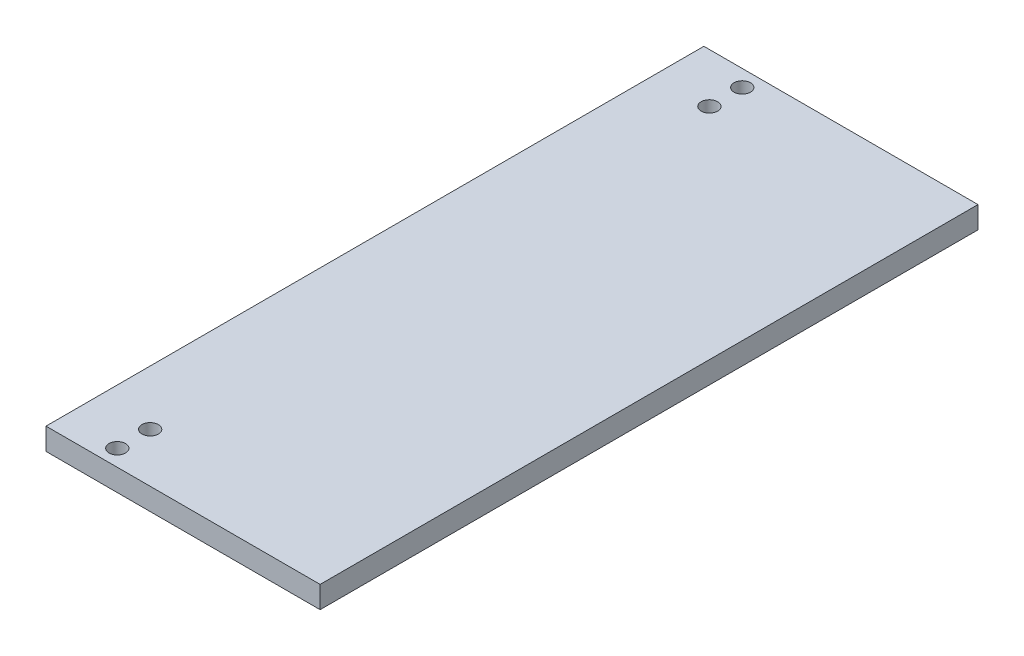
from build123d import *

# Parameters (mm, degrees)
SKETCH1_W           = 50
SKETCH1_H           = 120
BOSS_EXTRUDE1_DEPTH = 4
SKETCH2_R           = 1.5
CUT_EXTRUDE1_DEPTH  = 66.122960621


with BuildPart() as part:
    # Sketch1 → Boss-Extrude1 (new body)
    with BuildSketch(Plane(origin=(0, 0, 0), x_dir=(1, 0, 0), z_dir=(0, 1, 0))):
        Rectangle(SKETCH1_W, SKETCH1_H)
    extrude(amount=BOSS_EXTRUDE1_DEPTH)

    # Sketch2 → Cut-Extrude1 (cut, through all)
    with BuildSketch(Plane.XZ):
        with Locations(Location((-15, -57, 0), (0, 0, 270))):
            Circle(SKETCH2_R)
        with Locations(Location((-15, -51, 0), (0, 0, 270))):
            Circle(SKETCH2_R)
        with Locations(Location((-15, 51, 0), (0, 0, 270))):
            Circle(SKETCH2_R)
        with Locations(Location((-15, 57, 0), (0, 0, 270))):
            Circle(SKETCH2_R)
    extrude(amount=-CUT_EXTRUDE1_DEPTH, mode=Mode.SUBTRACT)


solid = part.part
